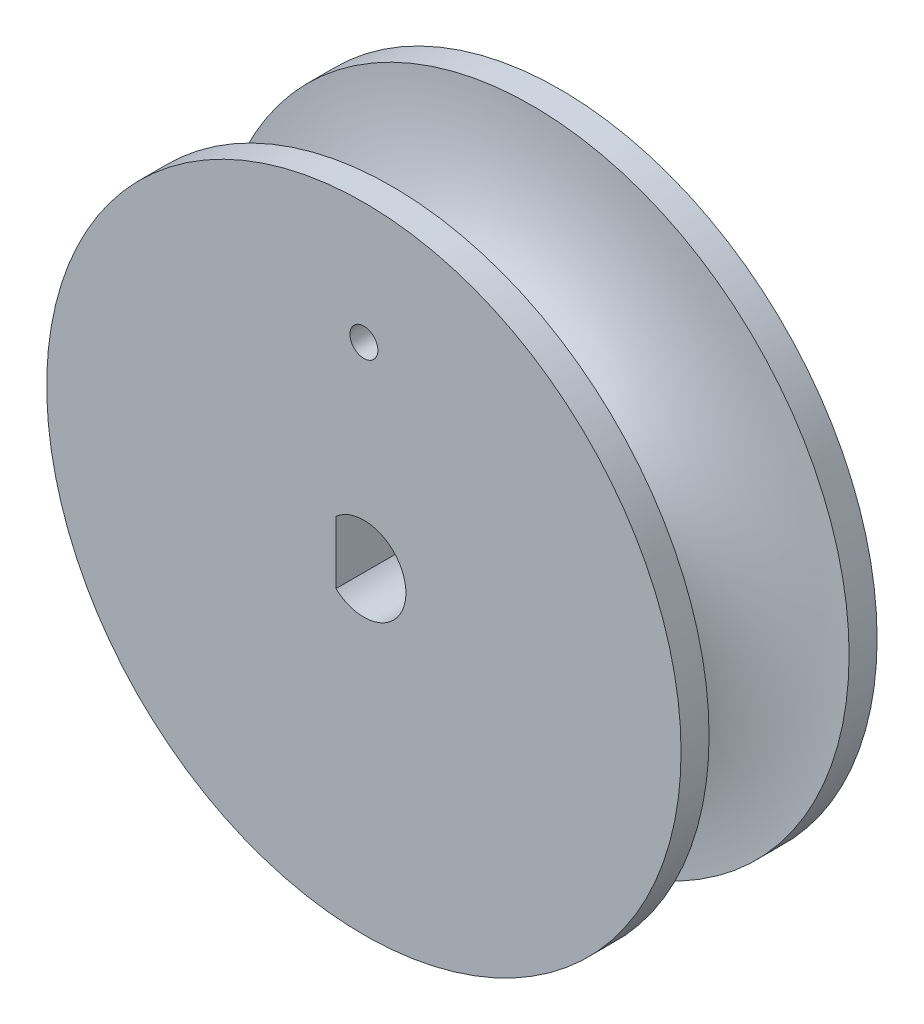
from build123d import *

# Parameters (mm, degrees)
BOSS_EXTRUDE1_START = -7
BOSS_EXTRUDE1_DEPTH = 7
SKETCH8_R           = 0.5
CUT_EXTRUDE1_DEPTH  = 3


with BuildPart() as part:
    # Sketch4 → Revolve1 (revolve)
    with BuildSketch(Plane(origin=(0, 0, 0), x_dir=(0, 0, -1), z_dir=(1, 0, 0)), mode=Mode.PRIVATE) as revolve1_sk:
        with BuildLine():
            Line((-2.5, 11.325), (-3.5, 11.325))
            Line((-3.5, 11.325), (-3.5, 1.5))
            Line((-3.5, 1.5), (3.5, 1.5))
            Line((3.5, 1.5), (3.5, 11.325))
            Line((3.5, 11.325), (2.5, 11.325))
            add(Edge.make_bspline(
                [(-2.5, 11.325), (-2.5, 5.764829973), (0, 5.764829973), (2.5, 5.764829973), (2.5, 11.325)],
                knots=[1.570796327, 1.570796327, 1.570796327, 3.141592654, 3.141592654, 4.71238898, 4.71238898, 4.71238898], degree=2, weights=[1, 0.707106781, 1, 0.707106781, 1]))
        make_face()
    revolve(revolve1_sk.sketch.rotate(Axis((0, 0, 0), (0, 0, -1)), 90), axis=Axis((0, 0, 0), (0, 0, -1)))

    # Sketch7 → Boss-Extrude1 (add)
    with BuildSketch(Plane.XY.offset(3.5).offset(BOSS_EXTRUDE1_START)):
        with BuildLine():
            Line((-1, 1.118033989), (-1, -1.118033989))
            ThreePointArc((-1, -1.118033989), (-1.5, 0), (-1, 1.118033989))
        make_face()
    extrude(amount=BOSS_EXTRUDE1_DEPTH)

    # Sketch8 → Cut-Extrude1 (cut)
    with BuildSketch(Plane.XY.offset(3.5)):
        with Locations((0, 7)):
            Circle(SKETCH8_R)
    extrude(amount=-CUT_EXTRUDE1_DEPTH, mode=Mode.SUBTRACT)


solid = part.part
